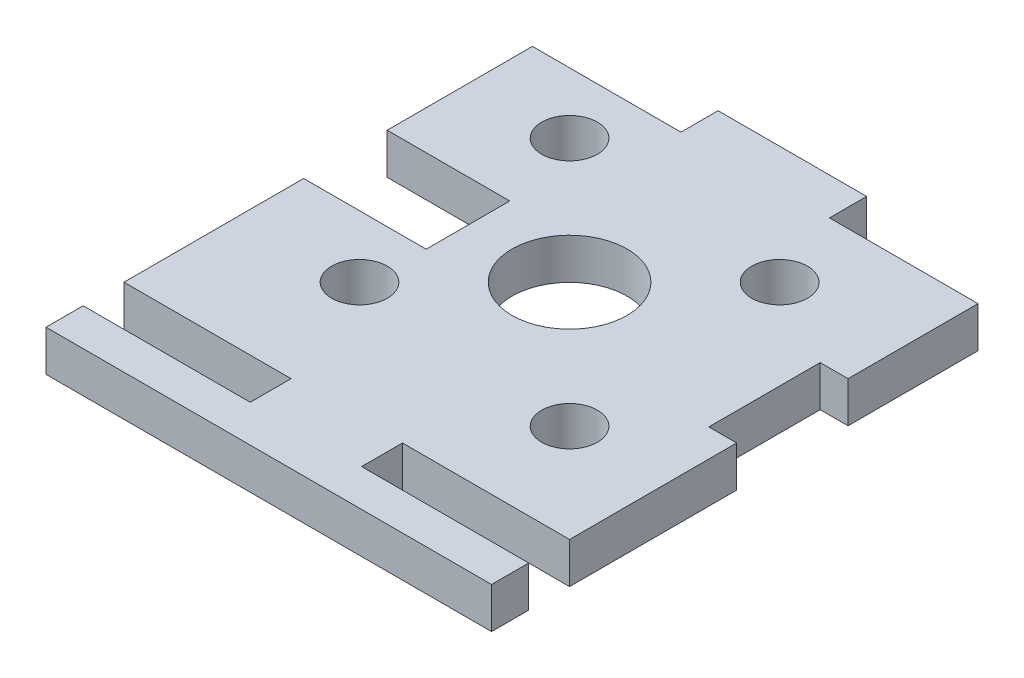
from build123d import *

# Parameters (mm, degrees)
SKETCH1_R           = 1.5
SKETCH1_R_2         = 3.1
BOSS_EXTRUDE1_DEPTH = 2.2


with BuildPart() as part:
    # Sketch1 → Boss-Extrude1 (new body)
    with BuildSketch(Plane(origin=(0, 0, 0), x_dir=(1, 0, 0), z_dir=(0, 1, 0))):
        Polygon((-145.195425431, -36.865904239), (-153.195425431, -36.865904239), (-153.195425431, -38.865904239), (-161.195425431, -38.865904239), (-161.195425431, -46.687876258), (-154.595425431, -46.687876258), (-154.595425431, -51.187876258), (-161.195425431, -51.187876258), (-161.195425431, -60.865904239), (-152.195425431, -60.865904239), (-152.195425431, -63.065904239), (-161.195425431, -63.065904239), (-161.195425431, -65.065904239), (-137.195425431, -65.065904239), (-137.195425431, -63.065904239), (-146.195425431, -63.065904239), (-146.195425431, -60.865904239), (-137.195425431, -60.865904239), (-137.195425431, -58.865904239), (-137.195425431, -51.865904239), (-138.695425431, -51.865904239), (-138.695425431, -45.865904239), (-137.195425431, -45.865904239), (-137.195425431, -38.865904239), (-145.195425431, -38.865904239), align=None)
        with Locations(Location((-154.852279681, -54.522758488, 0), (0, 0, 270))):
            Circle(SKETCH1_R, mode=Mode.SUBTRACT)
        with Locations(Location((-142.47791101, -55.58341866, 0), (0, 0, 270))):
            Circle(SKETCH1_R, mode=Mode.SUBTRACT)
        with Locations(Location((-149.195425431, -48.865904239, 0), (0, 0, 270))):
            Circle(SKETCH1_R_2, mode=Mode.SUBTRACT)
        with Locations(Location((-155.912939853, -42.148389817, 0), (0, 0, 270))):
            Circle(SKETCH1_R, mode=Mode.SUBTRACT)
        with Locations(Location((-143.538571182, -43.209049989, 0), (0, 0, 270))):
            Circle(SKETCH1_R, mode=Mode.SUBTRACT)
    extrude(amount=BOSS_EXTRUDE1_DEPTH)


solid = part.part
